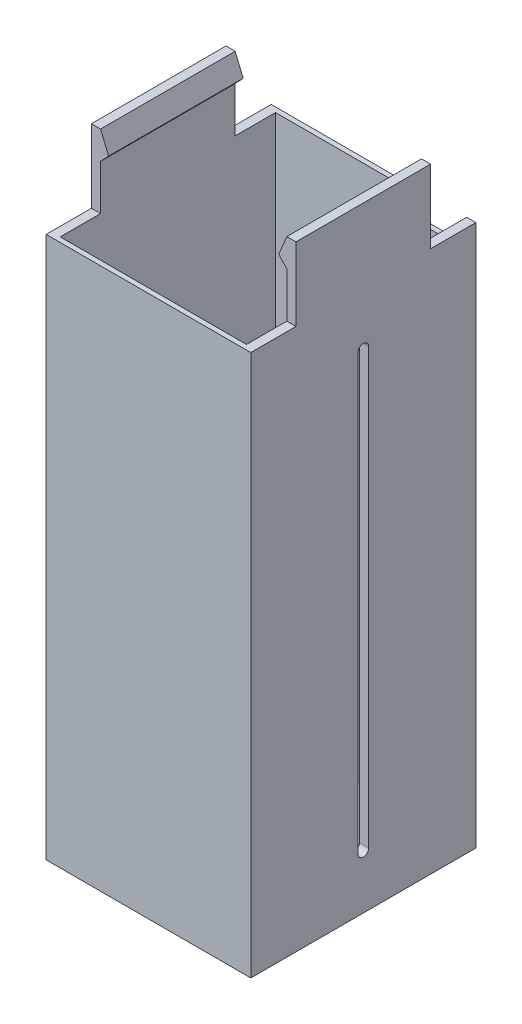
from build123d import *

# Parameters (mm, degrees)
SKETCH1_W           = 38
SKETCH1_H           = 41.8
SKETCH1_W_2         = 34.6
SKETCH1_H_2         = 40
BOSS_EXTRUDE1_DEPTH = 100
SKETCH2_W           = 1.7
SKETCH2_H           = 25
BOSS_EXTRUDE2_DEPTH = 13.6
BOSS_EXTRUDE5_DEPTH = 25
SKETCH6_W           = 38
SKETCH6_H           = 41.8
BOSS_EXTRUDE6_DEPTH = 0.6
SKETCH7_W           = 13.3
SKETCH7_H           = 4.4
CUT_EXTRUDE1_DEPTH  = 10
CUT_EXTRUDE2_DEPTH  = 10


with BuildPart() as part:
    # Sketch1 → Boss-Extrude1 (new body)
    with BuildSketch(Plane(origin=(0, 0, 0), x_dir=(1, 0, 0), z_dir=(0, 1, 0))):
        Rectangle(SKETCH1_W, SKETCH1_H)
        Rectangle(SKETCH1_W_2, SKETCH1_H_2, mode=Mode.SUBTRACT)
    extrude(amount=BOSS_EXTRUDE1_DEPTH)

    # Sketch2 → Boss-Extrude2 (add)
    with BuildSketch(Plane(origin=(0, 100, 0), x_dir=(1, 0, 0), z_dir=(0, 1, 0))):
        with Locations((18.15, 0)):
            Rectangle(SKETCH2_W, SKETCH2_H)
        with Locations((-18.15, 0)):
            Rectangle(SKETCH2_W, SKETCH2_H)
    extrude(amount=BOSS_EXTRUDE2_DEPTH)

    # Sketch5 → Boss-Extrude5 (add)
    with BuildSketch(Plane.XY.offset(12.5)):
        Polygon((-15.8, 110), (-17.3, 108.4), (-17.3, 113.6), align=None)
        Polygon((17.3, 108.4), (17.3, 113.6), (15.8, 110), align=None)
    extrude(amount=-BOSS_EXTRUDE5_DEPTH)

    # Sketch6 → Boss-Extrude6 (add)
    with BuildSketch(Plane.XZ):
        Rectangle(SKETCH6_W, SKETCH6_H)
    extrude(amount=BOSS_EXTRUDE6_DEPTH)

    # Sketch7 → Cut-Extrude1 (cut)
    with BuildSketch(Plane(origin=(0, 0, -20.9), x_dir=(-1, 0, 0), z_dir=(0, 0, -1))):
        with Locations((-10.65, 97.8)):
            Rectangle(SKETCH7_W, SKETCH7_H)
    extrude(amount=-CUT_EXTRUDE1_DEPTH, mode=Mode.SUBTRACT)

    # Sketch8 → Cut-Extrude2 (cut)
    with BuildSketch(Plane(origin=(19, 0, 0), x_dir=(0, 0, -1), z_dir=(1, 0, 0))):
        with BuildLine():
            Line((-1, 9.4), (-1, 90))
            ThreePointArc((-1, 90), (0, 91), (1, 90))
            Line((1, 90), (1, 9.4))
            ThreePointArc((1, 9.4), (0, 8.4), (-1, 9.4))
        make_face()
    extrude(amount=-CUT_EXTRUDE2_DEPTH, mode=Mode.SUBTRACT)


solid = part.part
